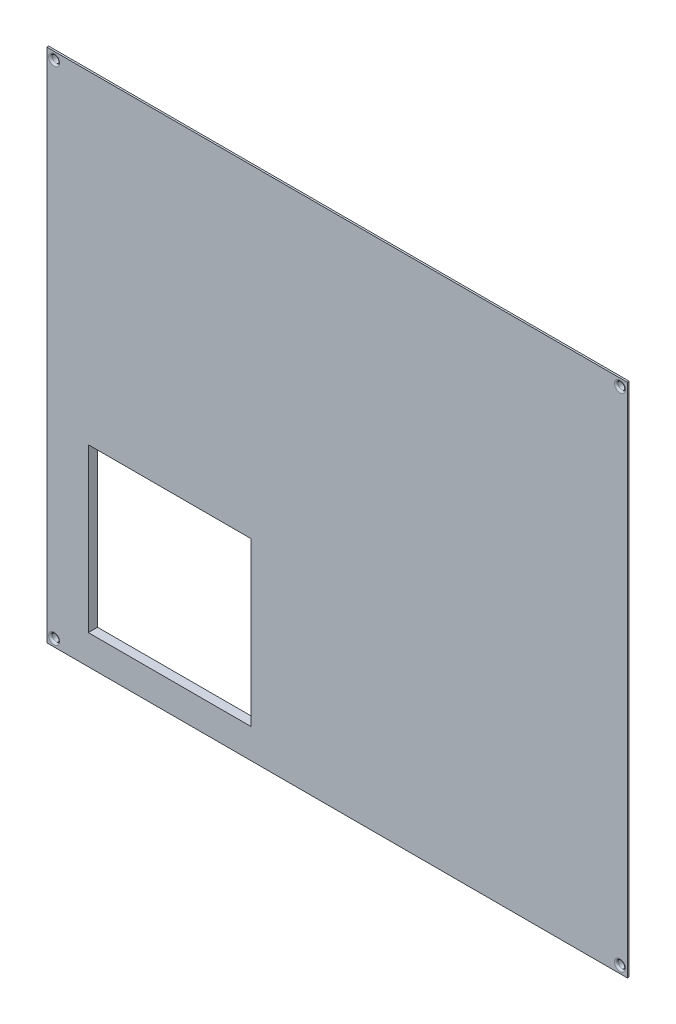
from build123d import *

# Parameters (mm, degrees)
SKETCH1_W           = 157
SKETCH1_H           = 139.5
BOSS_EXTRUDE1_DEPTH = 2.5
CHAMFER1_SIZE       = 2
SKETCH5_W           = 44
SKETCH5_H           = 44
CUT_EXTRUDE1_DEPTH  = 10
SKETCH6_R           = 1
CUT_EXTRUDE2_DEPTH  = 10
FILLET1_R           = 0.5


with BuildPart() as part:
    # Sketch1 → Boss-Extrude1 (new body)
    with BuildSketch(Plane.XY):
        with Locations((78.5, 69.75)):
            Rectangle(SKETCH1_W, SKETCH1_H)
    extrude(amount=BOSS_EXTRUDE1_DEPTH)

    # Chamfer1
    chamfer1_edges = [part.edges().sort_by_distance(p)[0] for p in [
        (78.5, 139.5, 0),
        (157, 69.75, 0),
        (78.5, 0, 0),
        (0, 69.75, 0),
    ]]
    chamfer(chamfer1_edges, length=CHAMFER1_SIZE)

    # Sketch5 → Cut-Extrude1 (cut)
    with BuildSketch(Plane(origin=(0, 0, 0), x_dir=(-1, 0, 0), z_dir=(0, 0, -1))):
        with Locations((-33.223972079, 30)):
            Rectangle(SKETCH5_W, SKETCH5_H)
    extrude(amount=-CUT_EXTRUDE1_DEPTH, mode=Mode.SUBTRACT)

    # Sketch6 → Cut-Extrude2 (cut)
    with BuildSketch(Plane.XY.offset(2.5)):
        with Locations((155, 137.5)):
            Circle(SKETCH6_R)
        with Locations((2, 137.5)):
            Circle(SKETCH6_R)
        with Locations((155, 2)):
            Circle(SKETCH6_R)
        with Locations((2, 2)):
            Circle(SKETCH6_R)
    extrude(amount=-CUT_EXTRUDE2_DEPTH, mode=Mode.SUBTRACT)

    # Fillet1
    fillet1_edges = [part.edges().sort_by_distance(p)[0] for p in [
        (154, 2, 2.5),
        (154, 137.5, 2.5),
        (1, 137.5, 2.5),
        (1, 2, 2.5),
    ]]
    fillet(fillet1_edges, radius=FILLET1_R)


solid = part.part
